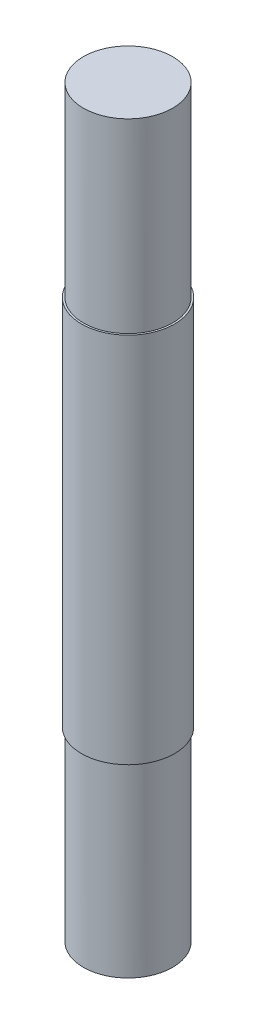
from build123d import *

# Parameters (mm, degrees)
SKETCH_1_R      = 2.4
EXTRUDE_1_DEPTH = 40
SKETCH_2_R      = 2.5
EXTRUDE_2_DEPTH = 10


with BuildPart() as part:
    # 草图1 → 凸台-拉伸1 (new body)
    with BuildSketch(Plane(origin=(0, 0, 0), x_dir=(1, 0, 0), z_dir=(0, 1, 0))):
        with Locations(Location((0, 0, 0), (0, 0, 270))):
            Circle(SKETCH_1_R)
    extrude(amount=EXTRUDE_1_DEPTH)

    # 草图2 → 凸台-拉伸2 (add, symmetric)
    with BuildSketch(Plane(origin=(0, 20, 0), x_dir=(-1, 0, 0), z_dir=(0, -1, 0))):
        with Locations(Location((0, 0, 0), (0, 0, 90))):
            Circle(SKETCH_2_R)
    extrude(amount=EXTRUDE_2_DEPTH, both=True)


solid = part.part
